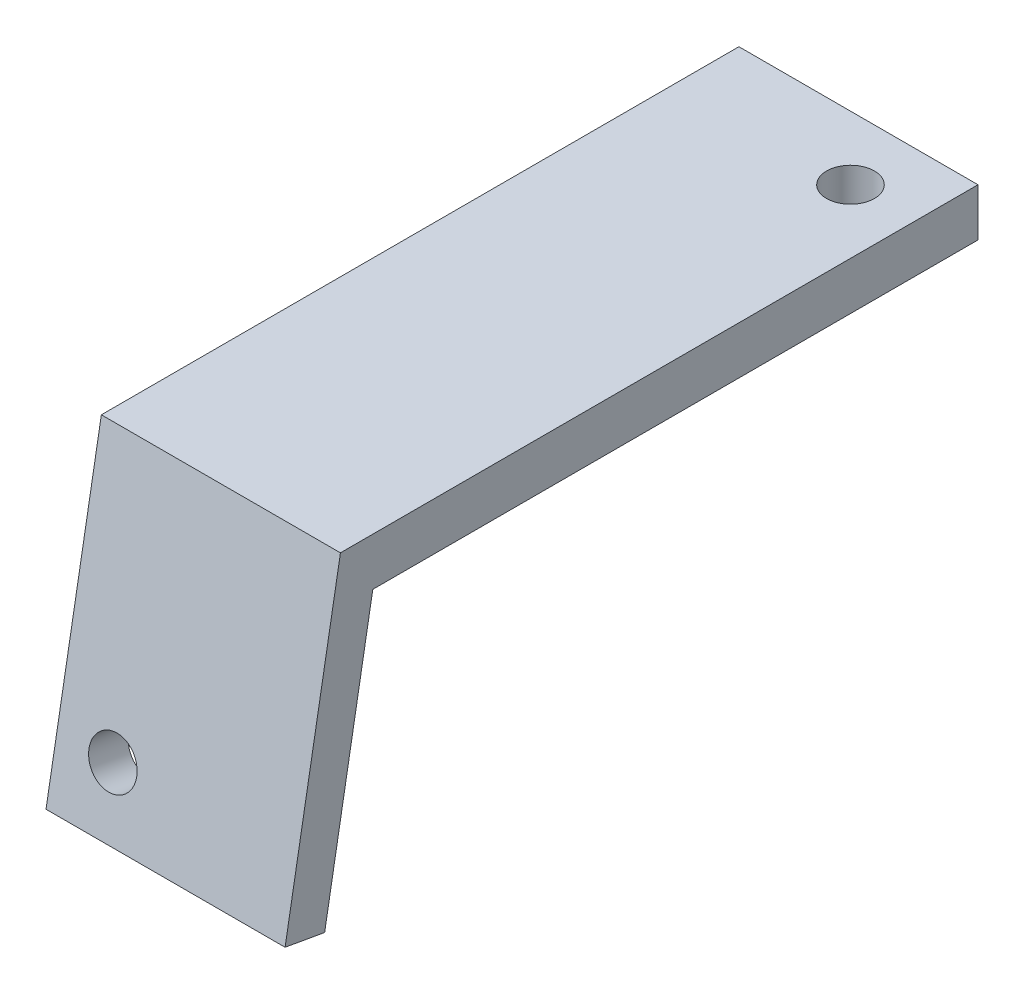
from build123d import *

# Parameters (mm, degrees)
SKETCH1_W           = 15
SKETCH1_H           = 40
SKETCH1_R           = 1.5
BOSS_EXTRUDE1_DEPTH = 3
SKETCH2_W           = 15
SKETCH2_H           = 2.520944533
BOSS_EXTRUDE2_DEPTH = 20
SKETCH3_R           = 1.5
CUT_EXTRUDE1_DEPTH  = 10


with BuildPart() as part:
    # Sketch1 → Boss-Extrude1 (new body)
    with BuildSketch(Plane(origin=(0, 0, 0), x_dir=(1, 0, 0), z_dir=(0, 1, 0))):
        Rectangle(SKETCH1_W, SKETCH1_H)
        with Locations(Location((3.5, 16, 0), (0, 0, 270))):
            Circle(SKETCH1_R, mode=Mode.SUBTRACT)
    extrude(amount=BOSS_EXTRUDE1_DEPTH)

    # Sketch2 → Boss-Extrude2 (add)
    with BuildSketch(Plane(origin=(0, -0.510662502, 0.090043577), x_dir=(1, 0, 0), z_dir=(0, 0.9848077530122075, -0.17364817766693402))):
        with Locations((0, -18.956627327)):
            Rectangle(SKETCH2_W, SKETCH2_H)
    extrude(amount=-BOSS_EXTRUDE2_DEPTH)

    # Sketch3 → Cut-Extrude1 (cut)
    with BuildSketch(Plane(origin=(0, 3.510662502, 19.909956423), x_dir=(1, 0, 0), z_dir=(0, 0.173648177666934, 0.9848077530122075))):
        with Locations(Location((-4, -16.518540294, 0), (0, 0, 270))):
            Circle(SKETCH3_R)
    extrude(amount=-CUT_EXTRUDE1_DEPTH, mode=Mode.SUBTRACT)


solid = part.part
